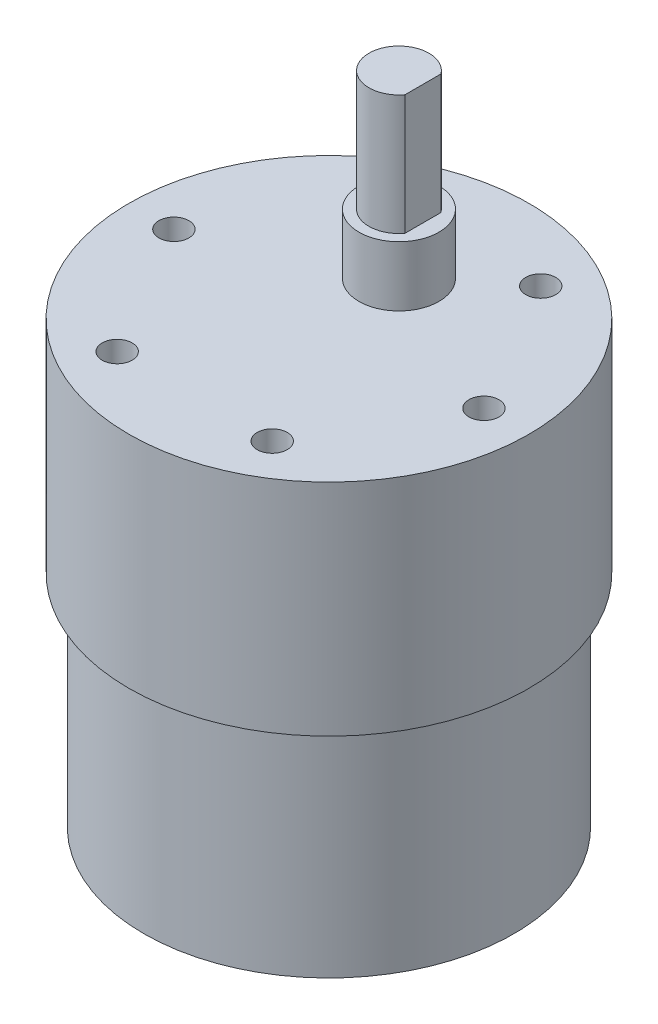
from build123d import *

# Parameters (mm, degrees)
SKETCH_1_R          = 18.5
EXTRUDE_1_DEPTH     = 22
SKETCH_2_R          = 20
EXTRUDE_2_DEPTH     = 22
SKETCH_3_R          = 1.5
CUT_EXTRUDE_1_DEPTH = 5
SKETCH_4_R          = 4
EXTRUDE_3_DEPTH     = 6
EXTRUDE_4_DEPTH     = 12


with BuildPart() as part:
    # 草图1 → 凸台-拉伸1 (new body)
    with BuildSketch(Plane(origin=(0, 0, 0), x_dir=(1, 0, 0), z_dir=(0, 1, 0))):
        with Locations(Location((0, 0, 0), (0, 0, 270))):
            Circle(SKETCH_1_R)
    extrude(amount=EXTRUDE_1_DEPTH)

    # 草图2 → 凸台-拉伸2 (add)
    with BuildSketch(Plane(origin=(0, 22, 0), x_dir=(1, 0, 0), z_dir=(0, 1, 0))):
        with Locations(Location((0, 0, 0), (0, 0, 270))):
            Circle(SKETCH_2_R)
    extrude(amount=EXTRUDE_2_DEPTH)

    # 草图3 → 切除-拉伸1 (cut)
    with BuildSketch(Plane(origin=(0, 44, 0), x_dir=(1, 0, 0), z_dir=(0, 1, 0))):
        with Locations(Location((-7.75, 13.423393759, 0), (0, 0, 270))):
            Circle(SKETCH_3_R)
        with Locations(Location((-15.5, 0, 0), (0, 0, 270))):
            Circle(SKETCH_3_R)
        with Locations(Location((-7.75, -13.423393759, 0), (0, 0, 270))):
            Circle(SKETCH_3_R)
        with Locations(Location((7.75, -13.423393759, 0), (0, 0, 270))):
            Circle(SKETCH_3_R)
        with Locations(Location((15.5, 0, 0), (0, 0, 270))):
            Circle(SKETCH_3_R)
        with Locations(Location((7.75, 13.423393759, 0), (0, 0, 270))):
            Circle(SKETCH_3_R)
    extrude(amount=-CUT_EXTRUDE_1_DEPTH, mode=Mode.SUBTRACT)

    # 草图4 → 凸台-拉伸3 (add)
    with BuildSketch(Plane(origin=(0, 44, 0), x_dir=(1, 0, 0), z_dir=(0, 1, 0))):
        with Locations(Location((0, 7, 0), (0, 0, 270))):
            Circle(SKETCH_4_R)
    extrude(amount=EXTRUDE_3_DEPTH)

    # 草图5 → 凸台-拉伸4 (add)
    with BuildSketch(Plane(origin=(0, 50, 0), x_dir=(1, 0, 0), z_dir=(0, 1, 0))):
        with BuildLine():
            Line((2.4, 8.8), (2.4, 5.2))
            ThreePointArc((2.4, 5.2), (-3, 7), (2.4, 8.8))
        make_face()
    extrude(amount=EXTRUDE_4_DEPTH)


solid = part.part
